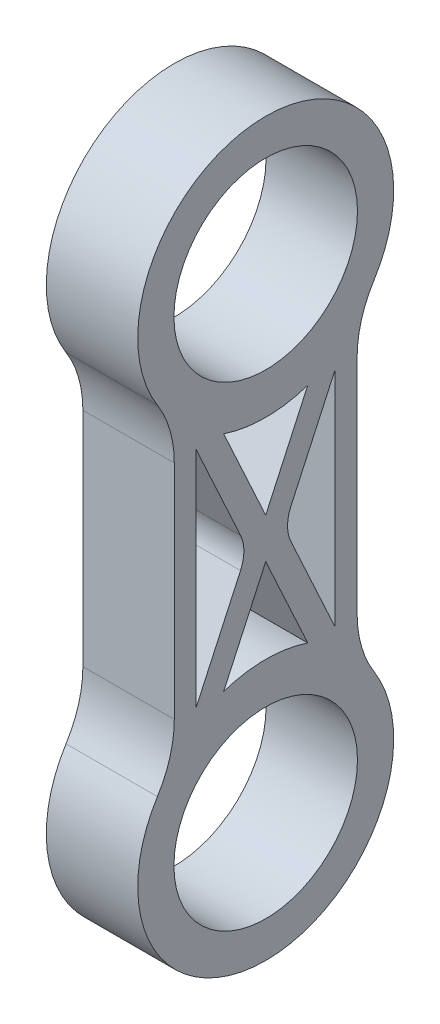
from build123d import *

# Parameters (mm, degrees)
BOSS_EXTRUDE3_DEPTH = 2.5
SKETCH4_R           = 3.5
BOSS_EXTRUDE4_DEPTH = 2.5
SKETCH5_R           = 2.51
CUT_EXTRUDE1_DEPTH  = 2.5
CUT_EXTRUDE2_DEPTH  = 2.5
FILLET2_R           = 3
FILLET3_R           = 1


with BuildPart() as part:
    # Sketch3 → Boss-Extrude3 (new body)
    with BuildSketch(Plane(origin=(0, 0, 0), x_dir=(0, 0, -1), z_dir=(1, 0, 0))):
        with BuildLine():
            Line((-35.995221199, 38.670285512), (-35.995221199, 25.670285512))
            ThreePointArc((-35.995221199, 25.670285512), (-33.495221199, 23.170285512), (-30.995221199, 25.670285512))
            Line((-30.995221199, 25.670285512), (-30.995221199, 38.670285512))
            ThreePointArc((-30.995221199, 38.670285512), (-33.495221199, 41.170285512), (-35.995221199, 38.670285512))
        make_face()
    extrude(amount=BOSS_EXTRUDE3_DEPTH)

    # Sketch4 → Boss-Extrude4 (add)
    with BuildSketch(Plane(origin=(2.5, 0, 0), x_dir=(0, 0, -1), z_dir=(1, 0, 0))):
        with Locations((-33.495221199, 38.670285512)):
            Circle(SKETCH4_R)
        with Locations((-33.495221199, 25.670285512)):
            Circle(SKETCH4_R)
    extrude(amount=-BOSS_EXTRUDE4_DEPTH)

    # Sketch5 → Cut-Extrude1 (cut)
    with BuildSketch(Plane(origin=(2.5, 0, 0), x_dir=(0, 0, -1), z_dir=(1, 0, 0))):
        with Locations((-33.495221199, 38.670285512)):
            Circle(SKETCH5_R)
        with Locations((-33.495221199, 25.670285512)):
            Circle(SKETCH5_R)
    extrude(amount=-CUT_EXTRUDE1_DEPTH, mode=Mode.SUBTRACT)

    # Sketch8 → Cut-Extrude2 (cut)
    with BuildSketch(Plane(origin=(2.5, 0, 0), x_dir=(0, 0, -1), z_dir=(1, 0, 0))):
        Polygon((-35.395221199, 35.220795769), (-35.395221199, 29.119775254), (-33.991986481, 32.170285512), align=None)
        Polygon((-31.595221199, 35.220795769), (-31.595221199, 29.119775254), (-32.998455917, 32.170285512), align=None)
        with BuildLine():
            Line((-34.645221199, 35.220795769), (-33.495221199, 32.720795769))
            Line((-33.495221199, 32.720795769), (-32.345221199, 35.220795769))
            ThreePointArc((-32.345221199, 35.220795769), (-33.495221199, 35.034150271), (-34.645221199, 35.220795769))
        make_face()
        with BuildLine():
            Line((-33.495221199, 31.619775254), (-32.345221199, 29.119775254))
            ThreePointArc((-32.345221199, 29.119775254), (-33.495221199, 29.306420752), (-34.645221199, 29.119775254))
            Line((-34.645221199, 29.119775254), (-33.495221199, 31.619775254))
        make_face()
    extrude(amount=-CUT_EXTRUDE2_DEPTH, mode=Mode.SUBTRACT)

    # Fillet2
    fillet2_edges = [part.edges().sort_by_distance(p)[0] for p in [
        (1.25, 36.220795769, 35.995221199),
        (1.25, 36.220795769, 30.995221199),
        (1.25, 28.119775254, 35.995221199),
        (1.25, 28.119775254, 30.995221199),
    ]]
    fillet(fillet2_edges, radius=FILLET2_R)

    # Fillet3
    fillet3_edges = [part.edges().sort_by_distance(p)[0] for p in [
        (1.25, 32.170285512, 32.998455917),
        (1.25, 32.170285512, 33.991986481),
    ]]
    fillet(fillet3_edges, radius=FILLET3_R)


solid = part.part
